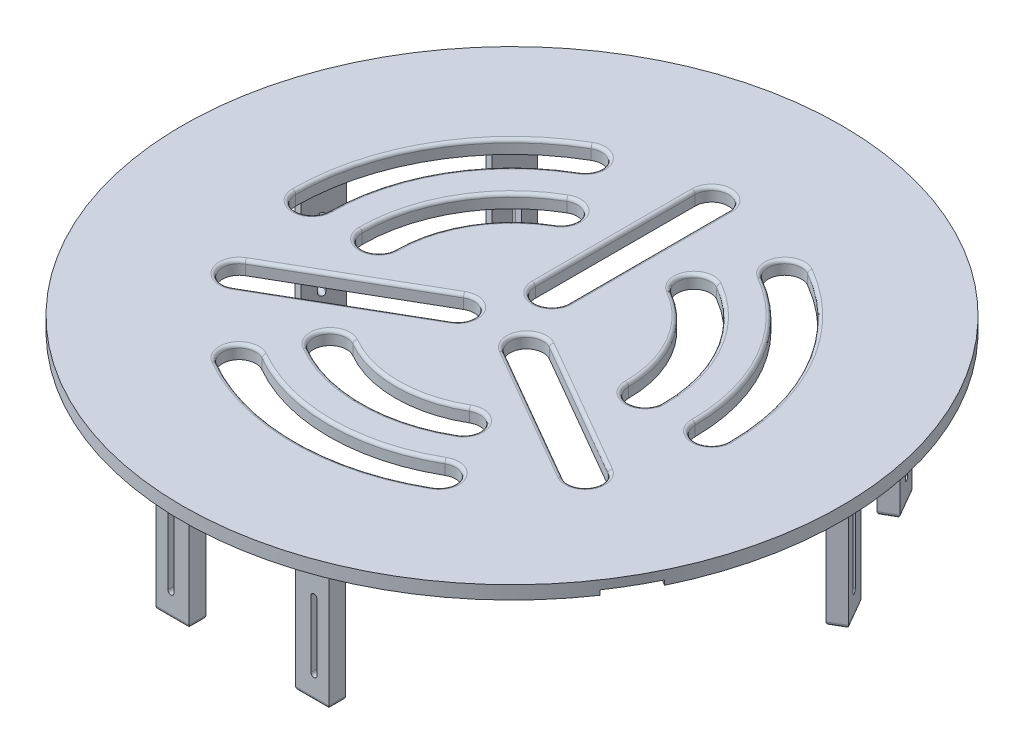
from build123d import *

# Parameters (mm, degrees)
SKETCH_1_R                           = 99
EXTRUDE_1_DEPTH                      = 4
SKETCH_6_W                           = 14.2
SKETCH_6_H                           = 26
CUT_EXTRUDE_1_DEPTH                  = 1.4
PATTERN_CIRCULAR_1_COUNT             = 3
SKETCH_7_W                           = 10
SKETCH_7_H                           = 5
EXTRUDE_2_DEPTH                      = 45
CUT_EXTRUDE_2_DEPTH                  = 148.061211745
CHAMFER_1_SIZE                       = 5
FILLET_1_R                           = 1
PATTERN_CIRCULAR_2_COUNT             = 3
CHAMFER_1_OF_PATTERN_CIRCULAR_2_SIZE = 5
FILLET_1_OF_PATTERN_CIRCULAR_2_R     = 1
CUT_EXTRUDE_5_DEPTH                  = 10
FILLET_2_R                           = 1


with BuildPart() as part:
    # 草图1 → 凸台-拉伸1 (new body)
    with BuildSketch(Plane(origin=(0, 0, 0), x_dir=(1, 0, 0), z_dir=(0, 1, 0))):
        with Locations(Location((0, 0, 0), (0, 0, 270))):
            Circle(SKETCH_1_R)
    extrude(amount=EXTRUDE_1_DEPTH)

    # 草图6 → 切除-拉伸1 (cut)
    with BuildSketch(Plane(origin=(0, 0, 0), x_dir=(1, 0, 0), z_dir=(0, 1, 0))):
        with Locations((0, 87)):
            Rectangle(SKETCH_6_W, SKETCH_6_H)
    cut_extrude_1 = extrude(amount=CUT_EXTRUDE_1_DEPTH, mode=Mode.SUBTRACT)

    # 阵列(圆周)1: 切除-拉伸1 ×3 about axis
    pattern_circular_1_axis = Axis((0, 0, 0), (0, 1, 0))
    for i in range(1, PATTERN_CIRCULAR_1_COUNT):
        add(cut_extrude_1.rotate(pattern_circular_1_axis, i * 360 / PATTERN_CIRCULAR_1_COUNT), mode=Mode.SUBTRACT)

    # 草图7 → 凸台-拉伸2 (add)
    with BuildSketch(Plane(origin=(0, 0, 0), x_dir=(1, 0, 0), z_dir=(0, 1, 0))):
        with Locations((-21, -78.5)):
            Rectangle(SKETCH_7_W, SKETCH_7_H)
        with Locations((21, -78.5)):
            Rectangle(SKETCH_7_W, SKETCH_7_H)
    extrude_2 = extrude(amount=-EXTRUDE_2_DEPTH)

    # 草图8 → 切除-拉伸2 (cut, through all)
    with BuildSketch(Plane.XY):
        with BuildLine():
            Line((-20.6, -18), (-20.6, -38))
            ThreePointArc((-20.6, -38), (-21.5, -38.9), (-22.4, -38))
            Line((-22.4, -38), (-22.4, -18))
            ThreePointArc((-22.4, -18), (-21.5, -17.1), (-20.6, -18))
        make_face()
        with BuildLine():
            Line((20.6, -18), (20.6, -38))
            ThreePointArc((20.6, -38), (21.5, -38.9), (22.4, -38))
            Line((22.4, -38), (22.4, -18))
            ThreePointArc((22.4, -18), (21.5, -17.1), (20.6, -18))
        make_face()
    cut_extrude_2 = extrude(amount=CUT_EXTRUDE_2_DEPTH, mode=Mode.SUBTRACT)

    # 倒角1
    chamfer_1_edges = [part.edges().sort_by_distance(p)[0] for p in [
        (21, 0, 81),
        (26, 0, 78.5),
        (21, 0, 76),
        (16, 0, 78.5),
        (-26, 0, 78.5),
        (-21, 0, 81),
        (-16, 0, 78.5),
        (-21, 0, 76),
    ]]
    chamfer(chamfer_1_edges, length=CHAMFER_1_SIZE)

    # 圆角1
    fillet_1_edges = [part.edges().sort_by_distance(p)[0] for p in [
        (21, -45, 81),
        (16, -45, 78.5),
        (21, -45, 76),
        (26, -45, 78.5),
        (-26, -45, 78.5),
        (-21, -45, 76),
        (-16, -45, 78.5),
        (-21, -45, 81),
    ]]
    fillet(fillet_1_edges, radius=FILLET_1_R)

    # 阵列(圆周)2: 凸台-拉伸2, 切除-拉伸2 ×3 about axis
    pattern_circular_2_axis = Axis((0, 0, 0), (0, 1, 0))
    add([extrude_2.rotate(pattern_circular_2_axis, i * 360 / PATTERN_CIRCULAR_2_COUNT) for i in range(1, PATTERN_CIRCULAR_2_COUNT)])
    add([cut_extrude_2.rotate(pattern_circular_2_axis, i * 360 / PATTERN_CIRCULAR_2_COUNT) for i in range(1, PATTERN_CIRCULAR_2_COUNT)], mode=Mode.SUBTRACT)

    # 倒角1 of 阵列(圆周)2
    chamfer_1_of_pattern_circular_2_edges = [part.edges().sort_by_distance(p)[0] for p in [
        (59.648057707, 0, -58.686533479),
        (54.982994197, 0, -61.766660498),
        (55.317930688, 0, -56.186533479),
        (59.982994197, 0, -53.106406461),
        (80.982994197, 0, -16.733339502),
        (80.648057707, 0, -22.313466521),
        (75.982994197, 0, -25.393593539),
        (76.317930688, 0, -19.813466521),
        (-80.648057707, 0, -22.313466521),
        (-80.982994197, 0, -16.733339502),
        (-76.317930688, 0, -19.813466521),
        (-75.982994197, 0, -25.393593539),
        (-54.982994197, 0, -61.766660498),
        (-59.648057707, 0, -58.686533479),
        (-59.982994197, 0, -53.106406461),
        (-55.317930688, 0, -56.186533479),
    ]]
    chamfer(chamfer_1_of_pattern_circular_2_edges, length=CHAMFER_1_OF_PATTERN_CIRCULAR_2_SIZE)

    # 圆角1 of 阵列(圆周)2
    fillet_1_of_pattern_circular_2_edges = [part.edges().sort_by_distance(p)[0] for p in [
        (59.648057707, -45, -58.686533479),
        (59.982994197, -45, -53.106406461),
        (55.317930688, -45, -56.186533479),
        (54.982994197, -45, -61.766660498),
        (80.982994197, -45, -16.733339502),
        (76.317930688, -45, -19.813466521),
        (75.982994197, -45, -25.393593539),
        (80.648057707, -45, -22.313466521),
        (-80.648057707, -45, -22.313466521),
        (-75.982994197, -45, -25.393593539),
        (-76.317930688, -45, -19.813466521),
        (-80.982994197, -45, -16.733339502),
        (-54.982994197, -45, -61.766660498),
        (-55.317930688, -45, -56.186533479),
        (-59.982994197, -45, -53.106406461),
        (-59.648057707, -45, -58.686533479),
    ]]
    fillet(fillet_1_of_pattern_circular_2_edges, radius=FILLET_1_OF_PATTERN_CIRCULAR_2_R)

    # 草图11 → 切除-拉伸5 (cut)
    with BuildSketch(Plane(origin=(0, 0, 0), x_dir=(1, 0, 0), z_dir=(0, 1, 0))):
        with BuildLine():
            Line((-5, 12), (-5, 60))
            ThreePointArc((-5, 60), (0, 65), (5, 60))
            Line((5, 60), (5, 12))
            ThreePointArc((5, 12), (0, 7), (-5, 12))
        make_face()
        with BuildLine():
            Line((7.892304845, -10.330127019), (49.461524227, -34.330127019))
            ThreePointArc((49.461524227, -34.330127019), (56.291651246, -32.5), (54.461524227, -25.669872981))
            Line((54.461524227, -25.669872981), (12.892304845, -1.669872981))
            ThreePointArc((12.892304845, -1.669872981), (6.062177826, -3.5), (7.892304845, -10.330127019))
        make_face()
        with BuildLine():
            Line((-12.892304845, -1.669872981), (-54.461524227, -25.669872981))
            ThreePointArc((-54.461524227, -25.669872981), (-56.291651246, -32.5), (-49.461524227, -34.330127019))
            Line((-49.461524227, -34.330127019), (-7.892304845, -10.330127019))
            ThreePointArc((-7.892304845, -10.330127019), (-6.062177826, -3.5), (-12.892304845, -1.669872981))
        make_face()
        with BuildLine():
            ThreePointArc((-32.5, 56.291651246), (-56.291651246, 32.5), (-65, 0))
            ThreePointArc((-65, 0), (-60, -5), (-55, 0))
            ThreePointArc((-55, 0), (-47.631397208, 27.5), (-27.5, 47.631397208))
            ThreePointArc((-27.5, 47.631397208), (-25.669872981, 54.461524227), (-32.5, 56.291651246))
        make_face()
        with BuildLine():
            ThreePointArc((-22.499946404, 38.971050339), (-38.971050339, 22.499946404), (-44.999892808, 0))
            ThreePointArc((-44.999892808, 0), (-40, -4.999892808), (-35.000107192, 0))
            ThreePointArc((-35.000107192, 0), (-30.310981963, 17.500053596), (-17.500053596, 30.310981963))
            ThreePointArc((-17.500053596, 30.310981963), (-15.669965812, 37.140962555), (-22.499946404, 38.971050339))
        make_face()
        with BuildLine():
            ThreePointArc((55, 0), (47.631397208, 27.5), (27.5, 47.631397208))
            ThreePointArc((27.5, 47.631397208), (25.669872981, 54.461524227), (32.5, 56.291651246))
            ThreePointArc((32.5, 56.291651246), (56.291651246, 32.5), (65, 0))
            ThreePointArc((65, 0), (60, -5), (55, 0))
        make_face()
        with BuildLine():
            ThreePointArc((44.999892808, 0), (38.971050339, 22.499946404), (22.499946404, 38.971050339))
            ThreePointArc((22.499946404, 38.971050339), (15.669965812, 37.140962555), (17.500053596, 30.310981963))
            ThreePointArc((17.500053596, 30.310981963), (30.310981963, 17.500053596), (35.000107192, 0))
            ThreePointArc((35.000107192, 0), (40, -4.999892808), (44.999892808, 0))
        make_face()
        with BuildLine():
            ThreePointArc((-27.5, -47.631397208), (0, -55), (27.5, -47.631397208))
            ThreePointArc((27.5, -47.631397208), (34.330127019, -49.461524227), (32.5, -56.291651246))
            ThreePointArc((32.5, -56.291651246), (0, -65), (-32.5, -56.291651246))
            ThreePointArc((-32.5, -56.291651246), (-34.330127019, -49.461524227), (-27.5, -47.631397208))
        make_face()
        with BuildLine():
            ThreePointArc((-22.499946404, -38.971050339), (0, -44.999892808), (22.499946404, -38.971050339))
            ThreePointArc((22.499946404, -38.971050339), (24.330034188, -32.141069747), (17.500053596, -30.310981963))
            ThreePointArc((17.500053596, -30.310981963), (0, -35.000107192), (-17.500053596, -30.310981963))
            ThreePointArc((-17.500053596, -30.310981963), (-24.330034188, -32.141069747), (-22.499946404, -38.971050339))
        make_face()
    extrude(amount=CUT_EXTRUDE_5_DEPTH, mode=Mode.SUBTRACT)

    # 圆角2
    fillet_2_edges = [part.edges().sort_by_distance(p)[0] for p in [
        (-5, 4, -36),
        (0, 4, -65),
        (5, 4, -36),
        (0, 4, -7),
        (30.310981963, 4, -17.500053596),
        (15.669965812, 4, -37.140962555),
        (38.971050339, 4, -22.499946404),
        (40, 4, 4.999892808),
        (-28.676914536, 4, 22.330127019),
        (-56.291651246, 4, 32.5),
        (-33.676914536, 4, 13.669872981),
        (-6.062177826, 4, 3.5),
        (-34.330127019, 4, 49.461524227),
        (0, 4, 55),
        (34.330127019, 4, 49.461524227),
        (0, 4, 65),
        (0, 4, 35.000107192),
        (24.330034188, 4, 32.141069747),
        (0, 4, 44.999892808),
        (-24.330034188, 4, 32.141069747),
        (33.676914536, 4, 13.669872981),
        (56.291651246, 4, 32.5),
        (28.676914536, 4, 22.330127019),
        (6.062177826, 4, 3.5),
        (60, 4, 5),
        (47.631397208, 4, -27.5),
        (25.669872981, 4, -54.461524227),
        (56.291651246, 4, -32.5),
        (-47.631397208, 4, -27.5),
        (-60, 4, 5),
        (-56.291651246, 4, -32.5),
        (-25.669872981, 4, -54.461524227),
        (-30.310981963, 4, -17.500053596),
        (-40, 4, 4.999892808),
        (-38.971050339, 4, -22.499946404),
        (-15.669965812, 4, -37.140962555),
    ]]
    fillet(fillet_2_edges, radius=FILLET_2_R)


solid = part.part
